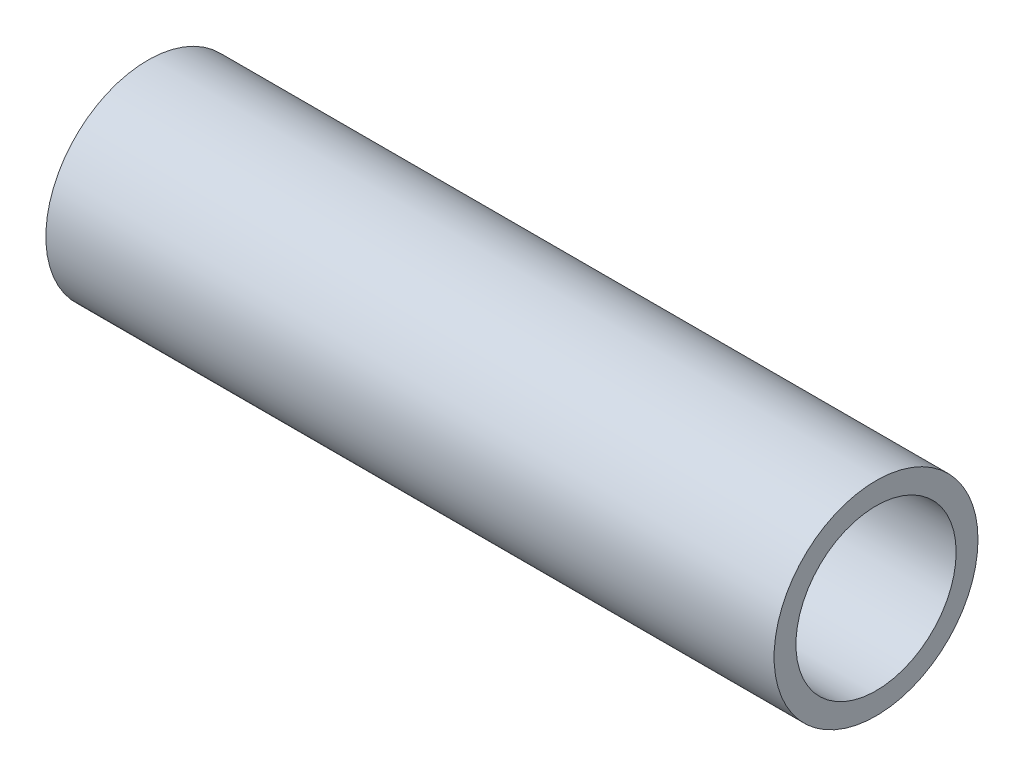
from build123d import *

# Parameters (mm, degrees)
SKETCH_3_R      = 14
SKETCH_3_R_2    = 11
EXTRUDE_1_DEPTH = 50


with BuildPart() as part:
    # 스케치3 → 보스-돌출1 (new, symmetric)
    with BuildSketch(Plane(origin=(0, 0, 0), x_dir=(0, 0, -1), z_dir=(1, 0, 0))):
        Circle(SKETCH_3_R)
        Circle(SKETCH_3_R_2, mode=Mode.SUBTRACT)
    extrude(amount=EXTRUDE_1_DEPTH, both=True)


solid = part.part
